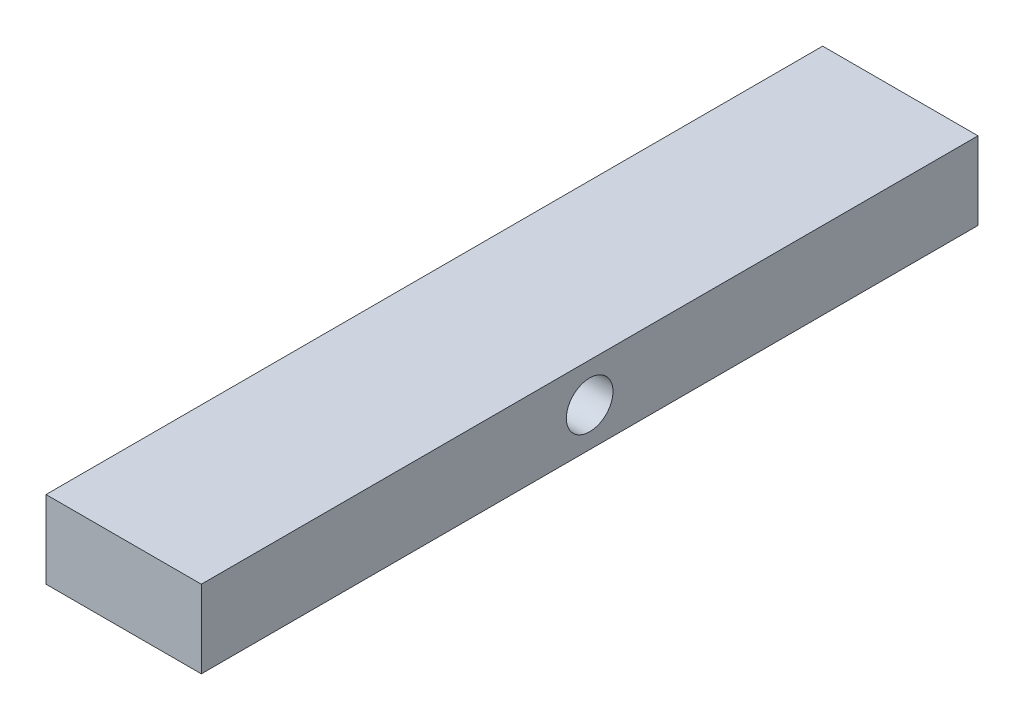
from build123d import *

# Parameters (mm, degrees)
SKETCH1_W           = 100
SKETCH1_H           = 50
BOSS_EXTRUDE1_DEPTH = 500
SKETCH2_R           = 15
CUT_EXTRUDE1_DEPTH  = 511.514446417


with BuildPart() as part:
    # Sketch1 → Boss-Extrude1 (new body)
    with BuildSketch(Plane.XY):
        Rectangle(SKETCH1_W, SKETCH1_H)
    extrude(amount=BOSS_EXTRUDE1_DEPTH)

    # Sketch2 → Cut-Extrude1 (cut, through all)
    with BuildSketch(Plane(origin=(50, 0, 0), x_dir=(0, 0, -1), z_dir=(1, 0, 0))):
        with Locations((-250, 0)):
            Circle(SKETCH2_R)
    extrude(amount=-CUT_EXTRUDE1_DEPTH, mode=Mode.SUBTRACT)


solid = part.part
